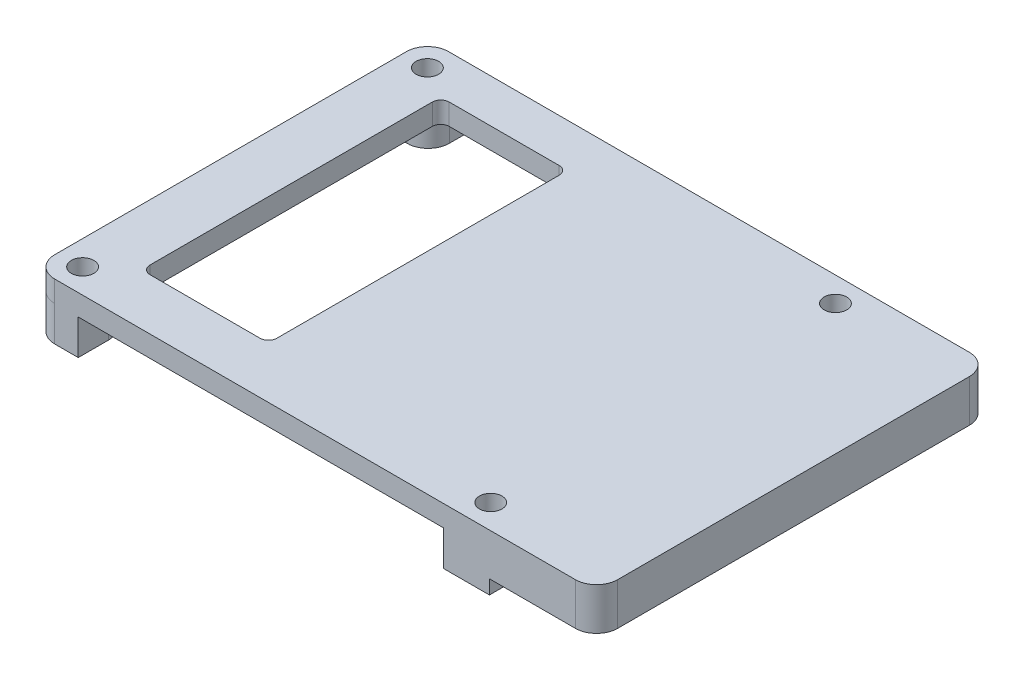
from build123d import *
from build123d.topology import SkipClean

# Parameters (mm, degrees)
SKETCH_1_R      = 1.6
EXTRUDE_1_DEPTH = 3
EXTRUDE_START   = 3
SKETCH_3_W      = 12.02170443
SKETCH_3_H      = 38.866282165
EXTRUDE_3_DEPTH = 3
EXTRUDE_START_2 = 5
SKETCH_4_R      = 1.6
EXTRUDE_4_DEPTH = 5


with BuildPart() as part:
    # 草图1 → 凸台-拉伸1 (new body)
    with BuildSketch(Plane(origin=(0, 0, 0), x_dir=(1, 0, 0), z_dir=(0, 1, 0))):
        with BuildLine():
            Line((-0.009028181, 21.389975432), (-0.009028181, -28.591736531))
            ThreePointArc((-0.009028181, -28.591736531), (-0.887707838, -30.713056875), (-3.009028181, -31.591736531))
            Line((-3.009028181, -31.591736531), (-77.021723127, -31.591736531))
            ThreePointArc((-77.021723127, -31.591736531), (-79.134066788, -30.716775138), (-80.009028181, -28.604431477))
            Line((-80.009028181, -28.604431477), (-80.009028181, 21.402670377))
            ThreePointArc((-80.009028181, 21.402670377), (-79.134066788, 23.515014039), (-77.021723127, 24.389975432))
            Line((-77.021723127, 24.389975432), (-3.009028181, 24.389975432))
            ThreePointArc((-3.009028181, 24.389975432), (-0.887707838, 23.511295776), (-0.009028181, 21.389975432))
        make_face()
        with Locations(Location((-76.52848462, 20.886724226, 0), (0, 0, 270))):
            Circle(SKETCH_1_R, mode=Mode.SUBTRACT)
        with Locations(Location((-18.52858622, 20.886597225, 0), (0, 0, 270))):
            Circle(SKETCH_1_R, mode=Mode.SUBTRACT)
        with Locations(Location((-18.52833222, -28.113656775, 0), (0, 0, 270))):
            Circle(SKETCH_1_R, mode=Mode.SUBTRACT)
        with Locations(Location((-76.52833222, -28.113529775, 0), (0, 0, 270))):
            Circle(SKETCH_1_R, mode=Mode.SUBTRACT)
        with BuildLine():
            Line((-70.770059731, 18.230282987), (-55.140568984, 18.230282987))
            ThreePointArc((-55.140568984, 18.230282987), (-54.292040846, 17.878811124), (-53.940568984, 17.030282987))
            Line((-53.940568984, 17.030282987), (-53.940568984, -23.088422311))
            ThreePointArc((-53.940568984, -23.088422311), (-54.292040846, -23.936950448), (-55.140568984, -24.288422311))
            Line((-55.140568984, -24.288422311), (-70.770059731, -24.288422311))
            ThreePointArc((-70.770059731, -24.288422311), (-71.618587868, -23.936950448), (-71.970059731, -23.088422311))
            Line((-71.970059731, -23.088422311), (-71.970059731, 17.030282987))
            ThreePointArc((-71.970059731, 17.030282987), (-71.618587868, 17.878811124), (-70.770059731, 18.230282987))
        make_face(mode=Mode.SUBTRACT)
    extrude(amount=EXTRUDE_1_DEPTH)

    # 草图3 → 凸台-拉伸3 (add)
    with BuildSketch(Plane.XZ.offset(EXTRUDE_START)):
        with BuildLine():
            Line((-15.227079657, 31.591736531), (-3.009028181, 31.591736531))
            ThreePointArc((-3.009028181, 31.591736531), (-0.887707838, 30.713056875), (-0.009028181, 28.591736531))
            Line((-0.009028181, 28.591736531), (-0.009028181, -21.389975432))
            ThreePointArc((-0.009028181, -21.389975432), (-0.887707838, -23.511295776), (-3.009028181, -24.389975432))
            Line((-3.009028181, -24.389975432), (-15.227079657, -24.389975432))
            Line((-15.227079657, -24.389975432), (-15.227079657, 31.591736531))
        make_face()
        with Locations((-30.854956036, 3.919082923)):
            Rectangle(SKETCH_3_W, SKETCH_3_H)
    extrude(amount=-EXTRUDE_3_DEPTH)

    # 草图4 → 凸台-拉伸4 (add)
    # profile 1 of 4: a face of its own
    with SkipClean():  # the faces are left unmerged after this step: merging them gives an invalid solid
        with BuildSketch(Plane.XZ.offset(EXTRUDE_START_2)):
            with BuildLine():
                Line((-80.009028181, 24.321697646), (-76.669469558, 24.321697646))
                ThreePointArc((-76.669469558, 24.321697646), (-74.548149215, 25.200377302), (-73.669469558, 27.321697646))
                Line((-73.669469558, 27.321697646), (-73.669469558, 31.591736531))
                Line((-73.669469558, 31.591736531), (-77.009028181, 31.591736531))
                ThreePointArc((-77.009028181, 31.591736531), (-79.130348525, 30.713056875), (-80.009028181, 28.591736531))
                Line((-80.009028181, 28.591736531), (-80.009028181, 24.321697646))
            make_face()
            with Locations(Location((-76.52833222, 28.113529775, 0), (0, 0, 270))):
                Circle(SKETCH_4_R, mode=Mode.SUBTRACT)
        # profile 2 of 4: a face of its own
        with BuildSketch(Plane.XZ.offset(EXTRUDE_START_2)):
            with BuildLine():
                Line((-15.227079657, 24.321697646), (-15.227079657, 31.591736531))
                Line((-15.227079657, 31.591736531), (-21.727079657, 31.591736531))
                Line((-21.727079657, 31.591736531), (-21.727079657, 27.321697646))
                ThreePointArc((-21.727079657, 27.321697646), (-20.848400001, 25.200377302), (-18.727079657, 24.321697646))
                Line((-18.727079657, 24.321697646), (-15.227079657, 24.321697646))
            make_face()
            with Locations(Location((-18.52833222, 28.113656775, 0), (0, 0, 270))):
                Circle(SKETCH_4_R, mode=Mode.SUBTRACT)
        # profile 3 of 4: a face of its own
        with BuildSketch(Plane.XZ.offset(EXTRUDE_START_2)):
            with BuildLine():
                Line((-21.727079657, -21.142340772), (-21.727079657, -24.389975432))
                Line((-21.727079657, -24.389975432), (-15.227079657, -24.389975432))
                Line((-15.227079657, -24.389975432), (-15.227079657, -18.142340772))
                Line((-15.227079657, -18.142340772), (-18.727079657, -18.142340772))
                ThreePointArc((-18.727079657, -18.142340772), (-20.848400001, -19.021020428), (-21.727079657, -21.142340772))
            make_face()
            with Locations(Location((-18.52858622, -20.886597225, 0), (0, 0, 270))):
                Circle(SKETCH_4_R, mode=Mode.SUBTRACT)
        # profile 4 of 4: a face of its own
        with BuildSketch(Plane.XZ.offset(EXTRUDE_START_2)):
            with BuildLine():
                Line((-80.009028181, -18.142340772), (-76.669469558, -18.142340772))
                ThreePointArc((-76.669469558, -18.142340772), (-74.548149215, -19.021020428), (-73.669469558, -21.142340772))
                Line((-73.669469558, -21.142340772), (-73.669469558, -24.388169156))
                Line((-73.669469558, -24.388169156), (-77.009028181, -24.388169156))
                ThreePointArc((-77.009028181, -24.388169156), (-79.130348525, -23.5094895), (-80.009028181, -21.388169156))
                Line((-80.009028181, -21.388169156), (-80.009028181, -18.142340772))
            make_face()
            with Locations(Location((-76.52848462, -20.886724226, 0), (0, 0, 270))):
                Circle(SKETCH_4_R, mode=Mode.SUBTRACT)
        extrude(amount=-EXTRUDE_4_DEPTH)


solid = part.part
